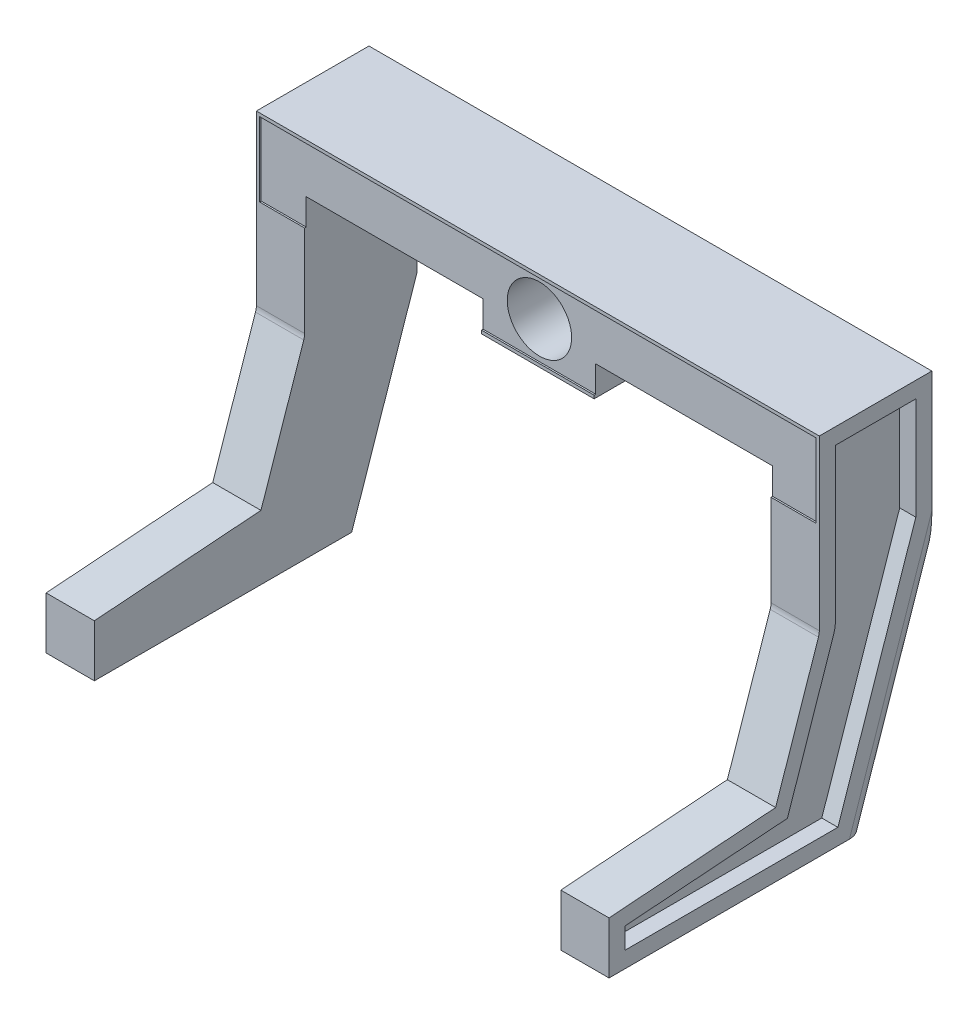
from build123d import *

# Parameters (mm, degrees)
SKETCH1_W               = 889
SKETCH1_H               = 127
BOSS_EXTRUDE1_DEPTH     = 177.8
SKETCH2_R               = 50.8
CUT_EXTRUDE1_DEPTH      = 496.3
SKETCH3_W               = 878.84
SKETCH3_H               = 116.84
SKETCH3_R               = 50.8
CUT_EXTRUDE2_DEPTH      = 2.54
SKETCH4_W               = 878.84
SKETCH4_H               = 116.84
CUT_EXTRUDE3_DEPTH      = 2.54
SKETCH5_W               = 177.8
SKETCH5_H               = 143.436769994
BOSS_EXTRUDE2_DEPTH     = 76.2
BOSS_EXTRUDE3_DEPTH     = 76.2
FILLET1_R               = 25.4
FILLET2_R               = 25.4
FILLET5_R               = 25.4
FILLET6_R               = 25.4
CUT_EXTRUDE5_DEPTH      = 25.4
CUT_EXTRUDE6_START      = -25.4
CUT_EXTRUDE6_DEPTH      = 25.4
CUT_EXTRUDE7_DEPTH      = 25.4
CUT_EXTRUDE7_DEPTH_BACK = 801.270015469
SKETCH12_W              = 279.4
SKETCH12_H              = 41.580374328
SKETCH12_H_2            = 85.419625672


with BuildPart() as part:
    # Sketch1 → Boss-Extrude1 (new body)
    with BuildSketch(Plane.XY):
        with Locations((0, -63.5)):
            Rectangle(SKETCH1_W, SKETCH1_H)
    extrude(amount=BOSS_EXTRUDE1_DEPTH)

    # Sketch2 → Cut-Extrude1 (cut, through all)
    with BuildSketch(Plane.XY.offset(177.8)):
        with Locations((0, -63.5)):
            Circle(SKETCH2_R)
    extrude(amount=-CUT_EXTRUDE1_DEPTH, mode=Mode.SUBTRACT)

    # Sketch3 → Cut-Extrude2 (cut)
    with BuildSketch(Plane.XY.offset(177.8)):
        with Locations((0, -63.5)):
            Rectangle(SKETCH3_W, SKETCH3_H)
        with Locations((0, -63.5)):
            Circle(SKETCH3_R, mode=Mode.SUBTRACT)
    extrude(amount=-CUT_EXTRUDE2_DEPTH, mode=Mode.SUBTRACT)

    # Sketch4 → Cut-Extrude3 (cut)
    with BuildSketch(Plane(origin=(0, 0, 0), x_dir=(-1, 0, 0), z_dir=(0, 0, -1))):
        with Locations((0, -63.5)):
            Rectangle(SKETCH4_W, SKETCH4_H)
    extrude(amount=-CUT_EXTRUDE3_DEPTH, mode=Mode.SUBTRACT)

    # Sketch5 → Boss-Extrude2 (add)
    with BuildSketch(Plane.ZY.offset(444.5)):
        Polygon((509.856034206, -575.236769994), (103.456034206, -575.236769994), (0, -270.436769994), (177.8, -270.436769994), (246.770689471, -473.636769994), (509.856034206, -493.059090132), align=None)
        with Locations((88.9, -198.718384997)):
            Rectangle(SKETCH5_W, SKETCH5_H)
    extrude(amount=-BOSS_EXTRUDE2_DEPTH)

    # Sketch8 → Boss-Extrude3 (add)
    with BuildSketch(Plane(origin=(444.5, 0, 0), x_dir=(0, 0, -1), z_dir=(1, 0, 0))):
        Polygon((-509.856034206, -575.236769994), (-103.456034206, -575.236769994), (0, -270.436769994), (0, -127), (-177.8, -127), (-177.8, -270.436769994), (-246.770689471, -473.636769994), (-509.856034206, -493.059090132), align=None)
    extrude(amount=-BOSS_EXTRUDE3_DEPTH)

    # Fillet1
    fillet1_edges = [part.edges().sort_by_distance(p)[0] for p in [
        (-406.4, -270.436769994, 177.8),
    ]]
    fillet(fillet1_edges, radius=FILLET1_R)

    # Fillet2
    fillet2_edges = [part.edges().sort_by_distance(p)[0] for p in [
        (406.4, -270.436769994, 177.8),
    ]]
    fillet(fillet2_edges, radius=FILLET2_R)

    # Fillet5
    fillet5_edges = [part.edges().sort_by_distance(p)[0] for p in [
        (444.5, -422.836769994, 51.728017103),
    ]]
    fillet(fillet5_edges, radius=FILLET5_R)

    # Fillet6
    fillet6_edges = [part.edges().sort_by_distance(p)[0] for p in [
        (-444.5, -422.836769994, 51.728017103),
    ]]
    fillet(fillet6_edges, radius=FILLET6_R)

    # Sketch10 → Cut-Extrude5 (cut)
    with BuildSketch(Plane(origin=(444.5, 0, 0), x_dir=(0, 0, -1), z_dir=(1, 0, 0))):
        with BuildLine():
            Line((-484.456034206, -549.836769994), (-148.481224008, -549.836769994))
            Line((-148.481224008, -549.836769994), (-25.4, -187.217447055))
            Line((-25.4, -187.217447055), (-25.4, -25.4))
            Line((-25.4, -25.4), (-152.4, -25.4))
            Line((-152.4, -25.4), (-152.4, -266.243582389))
            ThreePointArc((-152.4, -266.243582389), (-153.078401591, -274.517962908), (-155.095487125, -282.571345281))
            Line((-155.095487125, -282.571345281), (-228.125002086, -497.729371886))
            Line((-228.125002086, -497.729371886), (-484.456034206, -516.653053752))
            Line((-484.456034206, -516.653053752), (-484.456034206, -549.836769994))
        make_face()
    extrude(amount=-CUT_EXTRUDE5_DEPTH, mode=Mode.SUBTRACT)

    # Sketch11 → Cut-Extrude6 (cut)
    with BuildSketch(Plane.ZY.offset(444.5).offset(CUT_EXTRUDE6_START)):
        with BuildLine():
            Line((25.4, -25.4), (25.4, -187.217447055))
            Line((25.4, -187.217447055), (148.481224008, -549.836769994))
            Line((148.481224008, -549.836769994), (484.456034206, -549.836769994))
            Line((484.456034206, -549.836769994), (484.456034206, -516.653053752))
            Line((484.456034206, -516.653053752), (228.125002086, -497.729371886))
            Line((228.125002086, -497.729371886), (155.095487125, -282.571345281))
            ThreePointArc((155.095487125, -282.571345281), (153.078401591, -274.517962908), (152.4, -266.243582389))
            Line((152.4, -266.243582389), (152.4, -25.4))
            Line((152.4, -25.4), (25.4, -25.4))
        make_face()
    extrude(amount=CUT_EXTRUDE6_DEPTH, mode=Mode.SUBTRACT)

    # Sketch12 → Cut-Extrude7 (cut, two sides: drawn at the far end of the back side and taken through both)
    with BuildSketch(Plane.XY.offset(175.26).offset(-CUT_EXTRUDE7_DEPTH_BACK)):
        with Locations((-228.6, -101.129812836)):
            Rectangle(SKETCH12_W, SKETCH12_H)
        with Locations((-228.6, -164.629812836)):
            Rectangle(SKETCH12_W, SKETCH12_H_2)
        with Locations((228.6, -101.129812836)):
            Rectangle(SKETCH12_W, SKETCH12_H)
        with Locations((228.6, -164.629812836)):
            Rectangle(SKETCH12_W, SKETCH12_H_2)
    extrude(amount=CUT_EXTRUDE7_DEPTH + CUT_EXTRUDE7_DEPTH_BACK, mode=Mode.SUBTRACT)


solid = part.part
